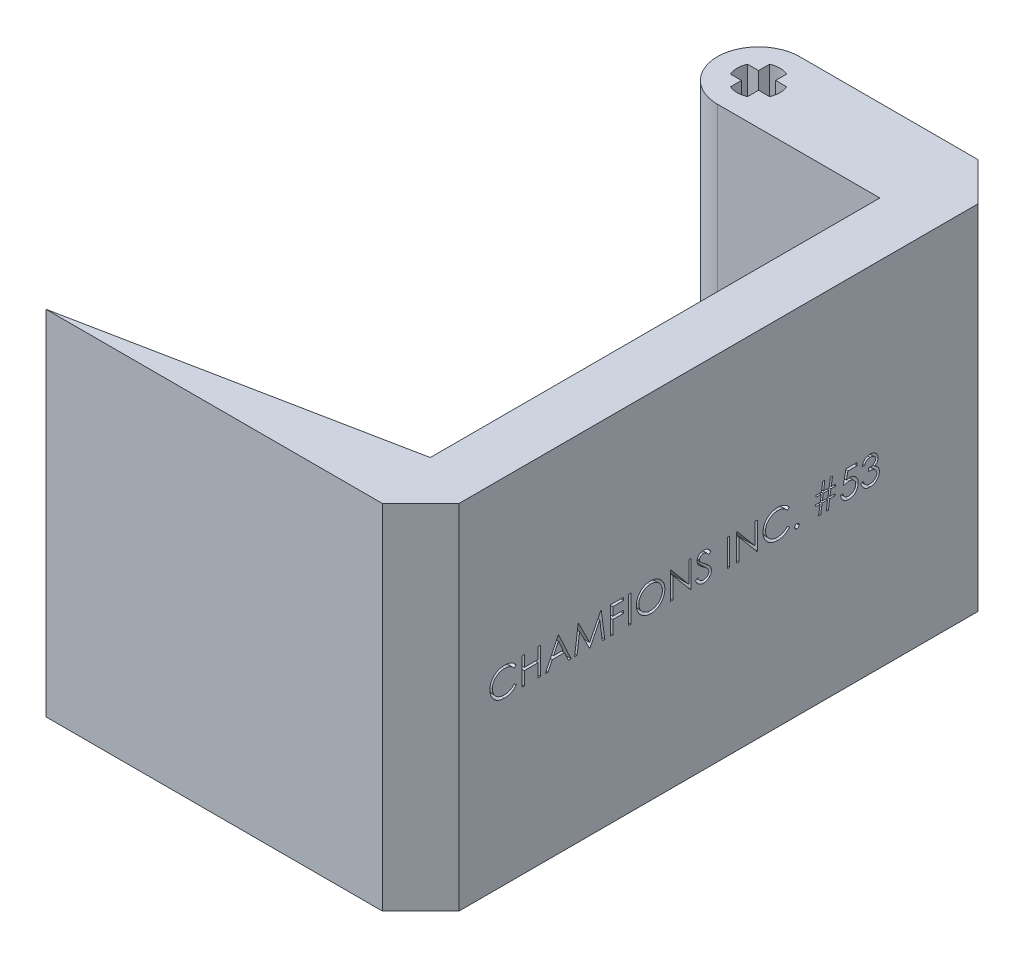
from build123d import *

# Parameters (mm, degrees)
BOSS_EXTRUDE6_DEPTH     = 41.402
CUT_EXTRUDE1_DEPTH      = 82.162837432
CUT_EXTRUDE2_DEPTH      = 82.162837432
CUT_EXTRUDE2_DEPTH_BACK = 82.162837432
SKETCH3_W               = 0.284935898
SKETCH3_H               = 3.175
SKETCH3_W_2             = 0.284935897


with BuildPart() as part:
    # Sketch1 → Boss-Extrude6 (new body)
    with BuildSketch(Plane(origin=(0, 0, 0), x_dir=(1, 0, 0), z_dir=(0, 1, 0))):
        with BuildLine():
            Line((25.4, 4.826), (0, 4.826))
            ThreePointArc((0, 4.826), (-4.826, 0), (0, -4.826))
            Line((0, -4.826), (19.05, -4.826))
            Line((19.05, -4.826), (19.05, -57.550565519))
            Line((19.05, -57.550565519), (-18.542, -65.024))
            Line((-18.542, -65.024), (25.4, -65.024))
            Line((25.4, -65.024), (25.4, 4.826))
        make_face()
        with BuildLine():
            Line((-1, 1), (-2.291287847, 1))
            ThreePointArc((-2.291287847, 1), (-2.5, 0), (-2.291287847, -1))
            Line((-2.291287847, -1), (-1, -1))
            Line((-1, -1), (-1, -2.291287847))
            ThreePointArc((-1, -2.291287847), (0, -2.5), (1, -2.291287847))
            Line((1, -2.291287847), (1, -1))
            Line((1, -1), (2.291287847, -1))
            ThreePointArc((2.291287847, -1), (2.5, 0), (2.291287847, 1))
            Line((2.291287847, 1), (1, 1))
            Line((1, 1), (1, 2.291287847))
            ThreePointArc((1, 2.291287847), (0, 2.5), (-1, 2.291287847))
            Line((-1, 2.291287847), (-1, 1))
        make_face(mode=Mode.SUBTRACT)
    extrude(amount=BOSS_EXTRUDE6_DEPTH)

    # Sketch2 → Cut-Extrude1 (cut, through all)
    with BuildSketch(Plane(origin=(0, 0, 0), x_dir=(1, 0, 0), z_dir=(0, 1, 0))):
        Polygon((25.4, -60.533871939), (20.909871939, -65.024), (25.4, -65.024), align=None)
        Polygon((25.4, 0.335871939), (20.909871939, 4.826), (25.4, 4.826), align=None)
    extrude(amount=CUT_EXTRUDE1_DEPTH, mode=Mode.SUBTRACT)

    # Sketch3 → Cut-Extrude2 (cut, two sides: drawn at the far end of the back side and taken through both)
    # profile 1 of 16: a face of its own
    with BuildSketch(Plane(origin=(0, 0, 0), x_dir=(0, 0, -1), z_dir=(1, 0, 0)).offset(-CUT_EXTRUDE2_DEPTH_BACK)):
        with BuildLine():
            Line((-53.812179487, 21.642407853), (-54.061498397, 21.451602564))
            add(Edge.make_bspline(
                [(-54.061498397, 21.451602564), (-54.079283739, 21.472798837), (-54.114614637, 21.51490561), (-54.171455485, 21.574032768), (-54.230693404, 21.629427684), (-54.29230575, 21.681354246), (-54.357401522, 21.727996598), (-54.424403818, 21.771785384), (-54.494433474, 21.811035404), (-54.591272547, 21.858626827), (-54.717953095, 21.90828941), (-54.877424128, 21.949930199), (-55.04389491, 21.97643798), (-55.157467018, 21.979308943), (-55.215234375, 21.980769231)],
                knots=[0, 0, 0, 0, 0.757959112, 1.505699292, 2.245454638, 2.979532153, 3.711538275, 4.438200793, 5.171680507, 5.909471876, 7.393775596, 8.890124382, 10.418191784, 12, 12, 12, 12], degree=3))
            add(Edge.make_bspline(
                [(-55.215234375, 21.980769231), (-55.247059939, 21.980402779), (-55.310415697, 21.979673277), (-55.404439669, 21.970049285), (-55.496707937, 21.956522687), (-55.587160482, 21.936451858), (-55.675682165, 21.911076696), (-55.762851701, 21.880755071), (-55.847407031, 21.843240323), (-55.930517862, 21.801776402), (-56.010146146, 21.754942934), (-56.085488939, 21.703858679), (-56.156271453, 21.649095284), (-56.22254968, 21.590447495), (-56.284391376, 21.528179431), (-56.341348436, 21.461627492), (-56.393223773, 21.391004449), (-56.441045645, 21.317241573), (-56.483874339, 21.240553719), (-56.519733587, 21.160657048), (-56.551488234, 21.078919754), (-56.576615404, 20.994418344), (-56.596504073, 20.907747406), (-56.610227024, 20.818674334), (-56.619741566, 20.727385211), (-56.620467441, 20.66550962), (-56.620833333, 20.634319912)],
                knots=[0, 0, 0, 0, 1.054917814, 2.100044995, 3.131103042, 4.146048494, 5.169673617, 6.183595914, 7.203665975, 8.234915748, 9.262203917, 10.264457458, 11.251630812, 12.227803204, 13.197192746, 14.159520551, 15.12972552, 16.100847026, 17.073214652, 18.039054194, 19.002613845, 19.979014051, 20.95965708, 21.949030935, 22.966165397, 24, 24, 24, 24], degree=3))
            add(Edge.make_bspline(
                [(-56.620833333, 20.634319912), (-56.619688683, 20.587392215), (-56.617441315, 20.495255905), (-56.597440326, 20.360299709), (-56.567046422, 20.231013097), (-56.52149372, 20.108204241), (-56.465324295, 19.990358801), (-56.394348883, 19.879470699), (-56.312146739, 19.773864244), (-56.217554944, 19.676035284), (-56.113772525, 19.586669262), (-56.002422634, 19.507974091), (-55.883782601, 19.442374162), (-55.759162373, 19.387785982), (-55.627602969, 19.345824522), (-55.48934097, 19.31628421), (-55.344677088, 19.297014518), (-55.245826276, 19.295169672), (-55.195517829, 19.294230769)],
                knots=[0, 0, 0, 0, 1.029171465, 2.020641659, 2.987623507, 3.938342917, 4.889210282, 5.84687017, 6.821220943, 7.821438502, 8.827599549, 9.822697543, 10.807740252, 11.797342354, 12.80366471, 13.83203677, 14.896651826, 16, 16, 16, 16], degree=3))
            add(Edge.make_bspline(
                [(-55.195517829, 19.294230769), (-55.140088961, 19.295762734), (-55.030991689, 19.298778006), (-54.871000694, 19.324322468), (-54.717842535, 19.365740722), (-54.571508974, 19.423705266), (-54.432412545, 19.499057348), (-54.300335575, 19.590404709), (-54.175166579, 19.698616268), (-54.099899773, 19.781241677), (-54.061498397, 19.823397436)],
                knots=[0, 0, 0, 0, 1.028121516, 2.023589091, 2.998037872, 3.967518031, 4.937445131, 5.927275754, 6.942489185, 8, 8, 8, 8], degree=3))
            Line((-54.061498397, 19.823397436), (-53.812179487, 19.6345002))
            add(Edge.make_bspline(
                [(-53.812179487, 19.6345002), (-53.832243773, 19.608611748), (-53.872276237, 19.556958846), (-53.937098866, 19.484140938), (-54.005386129, 19.415647992), (-54.077645237, 19.352032221), (-54.153044948, 19.29202067), (-54.232939117, 19.237318294), (-54.316277454, 19.187161564), (-54.402777588, 19.141235711), (-54.492347616, 19.100489351), (-54.58488021, 19.06560629), (-54.679976518, 19.035557283), (-54.777640886, 19.010835883), (-54.878075894, 18.991539972), (-54.98091911, 18.978640695), (-55.086392497, 18.969803387), (-55.157550072, 18.968997921), (-55.193609776, 18.968589744)],
                knots=[0, 0, 0, 0, 0.986787822, 1.968848986, 2.935600012, 3.899624008, 4.868462664, 5.837806735, 6.815139263, 7.798259679, 8.787526145, 9.778297419, 10.776456485, 11.791383307, 12.812564526, 13.85620153, 14.913611965, 16, 16, 16, 16], degree=3))
            add(Edge.make_bspline(
                [(-55.193609776, 18.968589744), (-55.227757959, 18.968827408), (-55.295281764, 18.969297361), (-55.394975631, 18.976910255), (-55.492030465, 18.987296803), (-55.586168876, 19.002936064), (-55.677904582, 19.021391287), (-55.766405969, 19.046130213), (-55.85254391, 19.073842671), (-55.935972334, 19.106413623), (-56.016762204, 19.143167589), (-56.094652947, 19.184707074), (-56.169608739, 19.230682766), (-56.242366514, 19.28008124), (-56.311851465, 19.334489221), (-56.378665734, 19.393151096), (-56.443183981, 19.455869149), (-56.483100702, 19.501094623), (-56.503170072, 19.523833133)],
                knots=[0, 0, 0, 0, 1.114604814, 2.203992996, 3.262667896, 4.300477797, 5.318619304, 6.316056647, 7.298880507, 8.271930387, 9.238335007, 10.195173496, 11.151986948, 12.108099108, 13.064862484, 14.031167946, 15.010108607, 16, 16, 16, 16], degree=3))
            add(Edge.make_bspline(
                [(-56.503170072, 19.523833133), (-56.535315263, 19.563331212), (-56.59921756, 19.641850513), (-56.68097443, 19.769109939), (-56.750958284, 19.901977528), (-56.807542155, 20.041151321), (-56.85177692, 20.186319022), (-56.882421289, 20.33755381), (-56.902334531, 20.494714444), (-56.904611721, 20.601609245), (-56.905769231, 20.655944511)],
                knots=[0, 0, 0, 0, 0.994628077, 1.977248131, 2.950237994, 3.925870899, 4.908910175, 5.911660606, 6.938484602, 8, 8, 8, 8], degree=3))
            add(Edge.make_bspline(
                [(-56.905769231, 20.655944511), (-56.904358448, 20.713054101), (-56.901582821, 20.825413654), (-56.878000921, 20.990308598), (-56.840065299, 21.148288795), (-56.786183835, 21.299059335), (-56.717871124, 21.443413232), (-56.633482696, 21.580247753), (-56.533998931, 21.710437993), (-56.420200066, 21.832008518), (-56.29540684, 21.943169216), (-56.161767631, 22.040964844), (-56.019544007, 22.122351447), (-55.870302813, 22.19038368), (-55.712926516, 22.242675443), (-55.547750889, 22.279281549), (-55.375086302, 22.302066361), (-55.25728253, 22.304946728), (-55.197425881, 22.306410256)],
                knots=[0, 0, 0, 0, 1.032925535, 2.032216505, 3.007276963, 3.968222605, 4.92396291, 5.891752235, 6.871517503, 7.883894988, 8.900124299, 9.891468569, 10.874487609, 11.85992873, 12.854644235, 13.869047385, 14.917252991, 16, 16, 16, 16], degree=3))
            add(Edge.make_bspline(
                [(-55.197425881, 22.306410256), (-55.16094561, 22.305972888), (-55.088736588, 22.305107162), (-54.98191811, 22.296665162), (-54.877921142, 22.282592104), (-54.776674037, 22.263436813), (-54.677684235, 22.239663028), (-54.581708303, 22.2086929), (-54.488183065, 22.17328119), (-54.39769837, 22.132497439), (-54.310688357, 22.086716895), (-54.227180125, 22.036447007), (-54.147837003, 21.981750098), (-54.07210069, 21.92309136), (-54.001238128, 21.85922981), (-53.933237358, 21.791921991), (-53.870407665, 21.719229165), (-53.83162441, 21.668061832), (-53.812179487, 21.642407853)],
                knots=[0, 0, 0, 0, 1.096760587, 2.17092713, 3.219439832, 4.250915756, 5.268269357, 6.278326846, 7.281116186, 8.274029601, 9.260640565, 10.235837813, 11.203064059, 12.156899882, 13.114053108, 14.069676657, 15.032185724, 16, 16, 16, 16], degree=3))
        make_face()
    # profile 2 of 16: a face of its own
    with BuildSketch(Plane(origin=(0, 0, 0), x_dir=(0, 0, -1), z_dir=(1, 0, 0)).offset(-CUT_EXTRUDE2_DEPTH_BACK)):
        Polygon((-53.160897436, 22.225), (-52.875961538, 22.225), (-52.875961538, 20.922435897), (-51.24775641, 20.922435897), (-51.24775641, 22.225), (-50.962820513, 22.225), (-50.962820513, 19.05), (-51.24775641, 19.05), (-51.24775641, 20.596794872), (-52.875961538, 20.596794872), (-52.875961538, 19.05), (-53.160897436, 19.05), align=None)
    # profile 3 of 16: a face of its own
    with BuildSketch(Plane(origin=(0, 0, 0), x_dir=(0, 0, -1), z_dir=(1, 0, 0)).offset(-CUT_EXTRUDE2_DEPTH_BACK)):
        Polygon((-48.846153846, 22.225), (-47.380769231, 19.05), (-47.690509816, 19.05), (-48.159890825, 20.067628205), (-49.599198718, 20.067628205), (-50.081936098, 19.05), (-50.392948718, 19.05), (-48.886858974, 22.225), align=None)
        Polygon((-48.869686498, 21.606154848), (-49.444646434, 20.393269231), (-48.309990986, 20.393269231), align=None, mode=Mode.SUBTRACT)
    # profile 4 of 16: a face of its own
    with BuildSketch(Plane(origin=(0, 0, 0), x_dir=(0, 0, -1), z_dir=(1, 0, 0)).offset(-CUT_EXTRUDE2_DEPTH_BACK)):
        Polygon((-46.973717949, 19.05), (-46.554582332, 22.225), (-46.513877204, 22.225), (-45.203044872, 19.619871795), (-43.895392628, 22.225), (-43.854051482, 22.225), (-43.432371795, 19.05), (-43.718579728, 19.05), (-44.022596154, 21.334575321), (-45.16869992, 19.05), (-45.2329377, 19.05), (-46.38349359, 21.339663462), (-46.686873998, 19.05), align=None)
    # profile 5 of 16: a face of its own
    with BuildSketch(Plane(origin=(0, 0, 0), x_dir=(0, 0, -1), z_dir=(1, 0, 0)).offset(-CUT_EXTRUDE2_DEPTH_BACK)):
        Polygon((-42.781089744, 22.225), (-41.234294872, 22.225), (-41.234294872, 21.899358974), (-42.496153846, 21.899358974), (-42.496153846, 20.922435897), (-41.234294872, 20.922435897), (-41.234294872, 20.596794872), (-42.496153846, 20.596794872), (-42.496153846, 19.05), (-42.781089744, 19.05), align=None)
    # profile 6 of 16: a face of its own
    with BuildSketch(Plane(origin=(0, 0, 0), x_dir=(0, 0, -1), z_dir=(1, 0, 0)).offset(-CUT_EXTRUDE2_DEPTH_BACK)):
        with Locations((-40.521955128, 20.6375)):
            Rectangle(SKETCH3_W, SKETCH3_H)
    # profile 7 of 16: a face of its own
    with BuildSketch(Plane(origin=(0, 0, 0), x_dir=(0, 0, -1), z_dir=(1, 0, 0)).offset(-CUT_EXTRUDE2_DEPTH_BACK)):
        with BuildLine():
            add(Edge.make_bspline(
                [(-38.079647436, 22.306410256), (-38.020857226, 22.3049212), (-37.905388402, 22.301996571), (-37.735684745, 22.279609098), (-37.57367348, 22.24087828), (-37.418034854, 22.189295432), (-37.270630511, 22.120484668), (-37.130350944, 22.03731314), (-36.997529923, 21.938909496), (-36.87395767, 21.826034411), (-36.760876007, 21.703222278), (-36.661248239, 21.572160174), (-36.57775273, 21.433640546), (-36.509185623, 21.28807965), (-36.455393313, 21.135806679), (-36.418273895, 20.976009834), (-36.394562858, 20.809724479), (-36.391790832, 20.696307252), (-36.390384615, 20.638772035)],
                knots=[0, 0, 0, 0, 1.065120563, 2.091984664, 3.0946048, 4.079830382, 5.057816894, 6.036188127, 7.030412546, 8.04752943, 9.064399622, 10.05169764, 11.02544977, 11.989514704, 12.962713494, 13.945757189, 14.957906945, 16, 16, 16, 16], degree=3))
            add(Edge.make_bspline(
                [(-36.390384615, 20.638772035), (-36.391790626, 20.581660637), (-36.394562035, 20.469087456), (-36.418300854, 20.303857332), (-36.455530904, 20.145025057), (-36.508686089, 19.992855786), (-36.576926344, 19.847188996), (-36.660977821, 19.708407974), (-36.75998449, 19.576467222), (-36.872657848, 19.452812161), (-36.995485936, 19.339421599), (-37.127230535, 19.240616618), (-37.264928761, 19.155595448), (-37.410352568, 19.087755973), (-37.561573316, 19.033534302), (-37.719944423, 18.996565845), (-37.884723797, 18.972719741), (-37.997092493, 18.969981516), (-38.054206731, 18.968589744)],
                knots=[0, 0, 0, 0, 1.043624062, 2.057103931, 3.04512605, 4.022047818, 4.998200453, 5.980619268, 6.982898556, 8.009068085, 9.034988726, 10.034168286, 11.015286542, 11.987931943, 12.962482838, 13.94673481, 14.956375938, 16, 16, 16, 16], degree=3))
            add(Edge.make_bspline(
                [(-38.054206731, 18.968589744), (-38.111741649, 18.969995259), (-38.225158287, 18.972765903), (-38.391652598, 18.996516178), (-38.551561694, 19.033655789), (-38.704428284, 19.086732206), (-38.850337613, 19.155327837), (-38.989575045, 19.238970381), (-39.1215817, 19.338218287), (-39.245263142, 19.450855109), (-39.358428486, 19.573475017), (-39.457088777, 19.704860377), (-39.54075013, 19.842433541), (-39.609115438, 19.986576295), (-39.663239626, 20.136591818), (-39.700164712, 20.293480794), (-39.724055182, 20.456348774), (-39.726808222, 20.567240546), (-39.728205128, 20.623507612)],
                knots=[0, 0, 0, 0, 1.053102029, 2.075944431, 3.073151272, 4.055350789, 5.033113405, 6.020478099, 7.024410459, 8.052272461, 9.079885166, 10.07527673, 11.055994387, 12.023226415, 12.992069828, 13.970394897, 14.97016774, 16, 16, 16, 16], degree=3))
            add(Edge.make_bspline(
                [(-39.728205128, 20.623507612), (-39.727720137, 20.661274391), (-39.726756274, 20.736331503), (-39.715152382, 20.847789061), (-39.698314267, 20.957454158), (-39.674182532, 21.065014947), (-39.64262152, 21.170208126), (-39.605381467, 21.273759175), (-39.559897464, 21.374618696), (-39.508480019, 21.473264487), (-39.451092522, 21.568158801), (-39.387705235, 21.657856709), (-39.320544579, 21.743110899), (-39.246917786, 21.821712109), (-39.16925144, 21.895946926), (-39.086285625, 21.964674534), (-38.998526589, 22.028514668), (-38.905596716, 22.086045977), (-38.809785852, 22.138078906), (-38.711019061, 22.182730157), (-38.610637743, 22.22105337), (-38.508171741, 22.25211469), (-38.403893155, 22.276636608), (-38.297574393, 22.293334708), (-38.189300156, 22.304968196), (-38.116355602, 22.305927501), (-38.079647436, 22.306410256)],
                knots=[0, 0, 0, 0, 1.037015668, 2.060948919, 3.074880161, 4.083647147, 5.086022904, 6.090072063, 7.104153813, 8.122640571, 9.144368836, 10.147691507, 11.138137339, 12.123020368, 13.103399296, 14.087645067, 15.080126199, 16.082011238, 17.087798457, 18.072939717, 19.057185487, 20.037253025, 21.01195951, 21.997135196, 22.992090687, 24, 24, 24, 24], degree=3))
        make_face()
        with BuildLine():
            add(Edge.make_bspline(
                [(-38.065655048, 21.980769231), (-38.095785466, 21.980401937), (-38.155758252, 21.979670862), (-38.244916367, 21.970040892), (-38.332901907, 21.956315921), (-38.419733043, 21.936738399), (-38.505046462, 21.910064722), (-38.58963739, 21.879366184), (-38.672734446, 21.841972766), (-38.754063302, 21.79972467), (-38.832907692, 21.752962435), (-38.907304928, 21.701280903), (-38.977447613, 21.645892072), (-39.043164004, 21.586666676), (-39.104261139, 21.523303109), (-39.161941547, 21.456761971), (-39.213893239, 21.385141327), (-39.261505155, 21.310383315), (-39.304111696, 21.232585309), (-39.341998839, 21.152566362), (-39.372990476, 21.069673747), (-39.398265631, 20.984806761), (-39.41922046, 20.898099815), (-39.432495519, 20.808895152), (-39.442231303, 20.717641015), (-39.442920591, 20.655971762), (-39.443269231, 20.624779647)],
                knots=[0, 0, 0, 0, 1.008559885, 2.007477868, 2.99961109, 3.989939068, 4.984837346, 5.991145699, 7.001802488, 8.033829008, 9.059044045, 10.069351652, 11.065060232, 12.050310815, 13.029377138, 14.011219647, 14.996725999, 15.989392538, 16.977580475, 17.965360261, 18.951710183, 19.937753436, 20.929683414, 21.935841486, 22.955955122, 24, 24, 24, 24], degree=3))
            add(Edge.make_bspline(
                [(-39.443269231, 20.624779647), (-39.442112749, 20.57891249), (-39.439837591, 20.488677602), (-39.419918938, 20.356445071), (-39.389237576, 20.229364983), (-39.344009822, 20.10813268), (-39.287448907, 19.99170608), (-39.217574514, 19.881118014), (-39.134789486, 19.776338592), (-39.040751859, 19.678099312), (-38.937951975, 19.588432047), (-38.828792998, 19.509725241), (-38.714444369, 19.443131657), (-38.594607892, 19.388879913), (-38.469923339, 19.34589065), (-38.339587274, 19.316427892), (-38.204467929, 19.297037301), (-38.11236512, 19.295175158), (-38.065655048, 19.294230769)],
                knots=[0, 0, 0, 0, 1.032063989, 2.030389145, 3.003944642, 3.970395727, 4.937377036, 5.913328081, 6.909231446, 7.93887556, 8.970685674, 9.976071282, 10.964166581, 11.944589148, 12.933237628, 13.927779006, 14.949070134, 16, 16, 16, 16], degree=3))
            add(Edge.make_bspline(
                [(-38.065655048, 19.294230769), (-38.034259286, 19.29466212), (-37.97199206, 19.295517617), (-37.879376836, 19.304134274), (-37.78843013, 19.317951755), (-37.699279505, 19.337845993), (-37.61202614, 19.36274453), (-37.526305854, 19.392324398), (-37.443031691, 19.429228061), (-37.361153124, 19.470002274), (-37.28277939, 19.516484417), (-37.2079623, 19.566411882), (-37.138587661, 19.62171913), (-37.072920432, 19.680064575), (-37.011572457, 19.742624637), (-36.954958593, 19.809317981), (-36.903269473, 19.880565577), (-36.855675637, 19.955210195), (-36.813218391, 20.033221081), (-36.776225923, 20.113530146), (-36.744842303, 20.195939638), (-36.71950716, 20.280568421), (-36.699653919, 20.367255762), (-36.685974278, 20.456117733), (-36.676405337, 20.546976565), (-36.675684088, 20.608429921), (-36.675320513, 20.639408053)],
                knots=[0, 0, 0, 0, 1.047197238, 2.076906641, 3.100256066, 4.114471768, 5.12198147, 6.126382909, 7.136867548, 8.15857795, 9.17633901, 10.174870724, 11.156907918, 12.133735059, 13.104061851, 14.077631395, 15.04955518, 16.038496417, 17.029181396, 18.010275684, 18.986308667, 19.968651475, 20.955262928, 21.950658345, 22.966943676, 24, 24, 24, 24], degree=3))
            add(Edge.make_bspline(
                [(-36.675320513, 20.639408053), (-36.67568438, 20.67017426), (-36.676406176, 20.7312047), (-36.685969707, 20.821429871), (-36.699668372, 20.909652427), (-36.719410257, 20.99552602), (-36.744855754, 21.079072539), (-36.776231403, 21.160213517), (-36.813229496, 21.239251237), (-36.855691243, 21.315990349), (-36.903421311, 21.389627433), (-36.955576803, 21.460023907), (-37.013058226, 21.525857751), (-37.074223263, 21.588754224), (-37.140599709, 21.647371881), (-37.21188689, 21.701730167), (-37.287219369, 21.753140923), (-37.366981933, 21.799519112), (-37.449299662, 21.842349166), (-37.533767324, 21.879044004), (-37.619428007, 21.910224427), (-37.706063881, 21.936819102), (-37.794404154, 21.956239244), (-37.883851913, 21.97005326), (-37.974283405, 21.97966751), (-38.035101183, 21.980400825), (-38.065655048, 21.980769231)],
                knots=[0, 0, 0, 0, 1.02996197, 2.043119294, 3.035359645, 4.018872909, 4.991431989, 5.957985074, 6.929999688, 7.912076566, 8.892894881, 9.867085534, 10.843653904, 11.817741046, 12.803660682, 13.806313499, 14.818574707, 15.856120519, 16.894564902, 17.924820532, 18.937903209, 19.946497019, 20.957711757, 21.963978472, 22.977135795, 24, 24, 24, 24], degree=3))
        make_face(mode=Mode.SUBTRACT)
    # profile 8 of 16: a face of its own
    with BuildSketch(Plane(origin=(0, 0, 0), x_dir=(0, 0, -1), z_dir=(1, 0, 0)).offset(-CUT_EXTRUDE2_DEPTH_BACK)):
        Polygon((-35.739102564, 19.05), (-35.739102564, 22.225), (-35.679316907, 22.225), (-33.581730769, 19.726086739), (-33.581730769, 22.225), (-33.296794872, 22.225), (-33.296794872, 19.05), (-33.36166867, 19.05), (-35.454166667, 21.543189103), (-35.454166667, 19.05), align=None)
    # profile 9 of 16: a face of its own
    with BuildSketch(Plane(origin=(0, 0, 0), x_dir=(0, 0, -1), z_dir=(1, 0, 0)).offset(-CUT_EXTRUDE2_DEPTH_BACK)):
        with BuildLine():
            Line((-32.808333333, 19.662484976), (-32.539933894, 19.823397436))
            add(Edge.make_bspline(
                [(-32.539933894, 19.823397436), (-32.514970922, 19.781610458), (-32.46714283, 19.701548221), (-32.387358383, 19.593364142), (-32.304687814, 19.501414185), (-32.218518918, 19.426233263), (-32.129377665, 19.367043201), (-32.036682131, 19.325131177), (-31.940744688, 19.29899097), (-31.87545415, 19.295815892), (-31.842858574, 19.294230769)],
                knots=[0, 0, 0, 0, 1.272034388, 2.437168799, 3.508375237, 4.49857839, 5.41946034, 6.295179144, 7.148887113, 8, 8, 8, 8], degree=3))
            add(Edge.make_bspline(
                [(-31.842858574, 19.294230769), (-31.815021207, 19.295006079), (-31.759833563, 19.296543133), (-31.678587814, 19.311312147), (-31.599682894, 19.334001721), (-31.524745058, 19.366496423), (-31.454808322, 19.405810621), (-31.393479391, 19.453296082), (-31.340460417, 19.506460283), (-31.29709072, 19.565771691), (-31.263816688, 19.62955939), (-31.238242455, 19.695033288), (-31.224050138, 19.763221918), (-31.221912226, 19.809132838), (-31.220833333, 19.832301683)],
                knots=[0, 0, 0, 0, 1.095163259, 2.171163733, 3.241058638, 4.321873601, 5.38011039, 6.391990106, 7.366004449, 8.327778327, 9.272591725, 10.192022065, 11.087607919, 12, 12, 12, 12], degree=3))
            add(Edge.make_bspline(
                [(-31.220833333, 19.832301683), (-31.222170744, 19.858736596), (-31.224889504, 19.912474913), (-31.247868775, 19.991758884), (-31.284017735, 20.070220001), (-31.317366704, 20.118753292), (-31.334680489, 20.143950321)],
                knots=[0, 0, 0, 0, 0.938893495, 1.908633276, 2.914225137, 4, 4, 4, 4], degree=3))
            add(Edge.make_bspline(
                [(-31.334680489, 20.143950321), (-31.348895975, 20.162135653), (-31.378739609, 20.200313485), (-31.430045352, 20.257141663), (-31.490248899, 20.3157598), (-31.557289981, 20.37840623), (-31.633610711, 20.442167303), (-31.716820671, 20.510083527), (-31.809044314, 20.5795721), (-31.873723143, 20.626174356), (-31.907096354, 20.650220353)],
                knots=[0, 0, 0, 0, 0.722233717, 1.516239348, 2.393582979, 3.351407094, 4.387010283, 5.505090956, 6.712668013, 8, 8, 8, 8], degree=3))
            add(Edge.make_bspline(
                [(-31.907096354, 20.650220353), (-31.940500979, 20.674013428), (-32.004368079, 20.719503978), (-32.093684078, 20.787017435), (-32.173552984, 20.848742946), (-32.243619806, 20.905261585), (-32.303853726, 20.95658102), (-32.354729392, 21.002208436), (-32.394950797, 21.043377809), (-32.417316931, 21.070085312), (-32.427358774, 21.082076322)],
                knots=[0, 0, 0, 0, 1.452282411, 2.77665338, 3.964542531, 5.026858415, 5.96415736, 6.766646006, 7.446254459, 8, 8, 8, 8], degree=3))
            add(Edge.make_bspline(
                [(-32.427358774, 21.082076322), (-32.441394583, 21.100764406), (-32.468997885, 21.13751703), (-32.50543419, 21.194961722), (-32.536403287, 21.253765684), (-32.560680546, 21.314086933), (-32.581124116, 21.375078618), (-32.594874524, 21.437536534), (-32.603484577, 21.501180424), (-32.604366308, 21.544009814), (-32.604807692, 21.56544972)],
                knots=[0, 0, 0, 0, 1.068054152, 2.10047183, 3.106115577, 4.101338837, 5.06977816, 6.043150881, 7.020423561, 8, 8, 8, 8], degree=3))
            add(Edge.make_bspline(
                [(-32.604807692, 21.56544972), (-32.603623681, 21.599041015), (-32.601280967, 21.665505616), (-32.581468497, 21.762597869), (-32.550196658, 21.855295548), (-32.506386296, 21.942680922), (-32.449909983, 22.022478633), (-32.384553992, 22.095606582), (-32.306710715, 22.157082367), (-32.221300835, 22.210796163), (-32.127813983, 22.252838538), (-32.029850807, 22.284553141), (-31.927255606, 22.302522968), (-31.857765619, 22.305101762), (-31.82250601, 22.306410256)],
                knots=[0, 0, 0, 0, 1.005424448, 1.989358655, 2.955360095, 3.929531133, 4.905563448, 5.876582895, 6.856512386, 7.866279853, 8.892233794, 9.918561126, 10.94386622, 12, 12, 12, 12], degree=3))
            add(Edge.make_bspline(
                [(-31.82250601, 22.306410256), (-31.785091719, 22.305119799), (-31.710686635, 22.302553491), (-31.601240561, 22.280240016), (-31.495866197, 22.243318692), (-31.411099807, 22.201418981), (-31.344757945, 22.159571197), (-31.294164108, 22.121453213), (-31.242894707, 22.077570079), (-31.190536186, 22.027804906), (-31.13797573, 21.971701067), (-31.084433027, 21.9096428), (-31.029782869, 21.842009352), (-30.994625767, 21.793727127), (-30.976602564, 21.768975361)],
                knots=[0, 0, 0, 0, 1.286793592, 2.559021753, 3.825965368, 5.121522368, 5.803751409, 6.523245864, 7.299691795, 8.125521123, 9.008227632, 9.944561021, 10.946284179, 12, 12, 12, 12], degree=3))
            Line((-30.976602564, 21.768975361), (-31.234189704, 21.573717949))
            add(Edge.make_bspline(
                [(-31.234189704, 21.573717949), (-31.249743514, 21.593755546), (-31.279696515, 21.632343275), (-31.325171121, 21.686382968), (-31.368032395, 21.735746489), (-31.410260258, 21.778622712), (-31.44962448, 21.817359647), (-31.487830654, 21.85052457), (-31.524328959, 21.878442431), (-31.570336442, 21.908236232), (-31.628137515, 21.937769632), (-31.700694916, 21.962760581), (-31.776519608, 21.977778387), (-31.828162917, 21.979764021), (-31.854306891, 21.980769231)],
                knots=[0, 0, 0, 0, 1.181633172, 2.275549214, 3.290209073, 4.226197932, 5.078386478, 5.862611352, 6.581680152, 7.217281963, 8.414376989, 9.595101626, 10.782541182, 12, 12, 12, 12], degree=3))
            add(Edge.make_bspline(
                [(-31.854306891, 21.980769231), (-31.887106022, 21.979670046), (-31.950356057, 21.977550371), (-32.040154342, 21.954400099), (-32.12097526, 21.917949411), (-32.190419372, 21.866863681), (-32.248237916, 21.806338209), (-32.290062153, 21.736688819), (-32.315235517, 21.659779068), (-32.318307356, 21.606129137), (-32.319871795, 21.57880609)],
                knots=[0, 0, 0, 0, 1.14458467, 2.207223713, 3.21896685, 4.227309161, 5.202851033, 6.127160689, 7.046193047, 8, 8, 8, 8], degree=3))
            add(Edge.make_bspline(
                [(-32.319871795, 21.57880609), (-32.319515173, 21.56179582), (-32.318801346, 21.527747465), (-32.308845636, 21.477445104), (-32.296055531, 21.427269817), (-32.275787572, 21.377447189), (-32.247806475, 21.327105877), (-32.211062494, 21.275379015), (-32.164786132, 21.22181068), (-32.1293377, 21.186969705), (-32.110621995, 21.16857472)],
                knots=[0, 0, 0, 0, 0.858281714, 1.717966888, 2.583508476, 3.4729293, 4.427298488, 5.488583878, 6.674047936, 8, 8, 8, 8], degree=3))
            add(Edge.make_bspline(
                [(-32.110621995, 21.16857472), (-32.103672036, 21.16237256), (-32.087160524, 21.14763765), (-32.056974505, 21.123514653), (-32.01711211, 21.093757852), (-31.968614256, 21.056939358), (-31.910586721, 21.014229746), (-31.843023123, 20.966175112), (-31.76667659, 20.911215445), (-31.71250028, 20.872791105), (-31.683854167, 20.852473958)],
                knots=[0, 0, 0, 0, 0.420754252, 0.999615792, 1.744751191, 2.668019286, 3.750313428, 4.999500688, 6.413464383, 8, 8, 8, 8], degree=3))
            add(Edge.make_bspline(
                [(-31.683854167, 20.852473958), (-31.649395517, 20.827399296), (-31.582671117, 20.778845689), (-31.487731741, 20.705897179), (-31.401649501, 20.634552418), (-31.324122166, 20.565267017), (-31.254383828, 20.498566533), (-31.193208181, 20.433648505), (-31.139971885, 20.370978021), (-31.082659309, 20.290630042), (-31.024096144, 20.191950058), (-30.973802776, 20.071047656), (-30.942090561, 19.949675279), (-30.937943544, 19.868098792), (-30.935897436, 19.827849559)],
                knots=[0, 0, 0, 0, 1.163667725, 2.253281268, 3.268753668, 4.215851969, 5.092017293, 5.902905408, 6.650798638, 7.335211899, 8.59617414, 9.77448103, 10.901945474, 12, 12, 12, 12], degree=3))
            add(Edge.make_bspline(
                [(-30.935897436, 19.827849559), (-30.936493554, 19.7993849), (-30.937674214, 19.743008344), (-30.9512459, 19.660226953), (-30.971130168, 19.579826093), (-31.001099659, 19.502799584), (-31.037678524, 19.427738263), (-31.08409362, 19.356611097), (-31.137894163, 19.287843864), (-31.199610506, 19.223270268), (-31.267143575, 19.163991933), (-31.338520927, 19.11126057), (-31.413859388, 19.067292877), (-31.492750261, 19.031414613), (-31.575211667, 19.003353493), (-31.661215871, 18.983021819), (-31.750904642, 18.970543424), (-31.811865079, 18.969248241), (-31.842858574, 18.968589744)],
                knots=[0, 0, 0, 0, 0.983748083, 1.948392443, 2.894712957, 3.844097841, 4.80183111, 5.778335162, 6.776009319, 7.81870978, 8.863265674, 9.881300176, 10.883814829, 11.87499822, 12.874611388, 13.892143829, 14.928324115, 16, 16, 16, 16], degree=3))
            add(Edge.make_bspline(
                [(-31.842858574, 18.968589744), (-31.866839206, 18.969053458), (-31.91449846, 18.969975048), (-31.984992061, 18.978122352), (-32.054061546, 18.98964951), (-32.120840216, 19.007950274), (-32.186188439, 19.030154389), (-32.249822002, 19.057494162), (-32.311771744, 19.090257623), (-32.372384837, 19.12771811), (-32.431507124, 19.17131335), (-32.48858407, 19.222089307), (-32.545488402, 19.278645587), (-32.600540541, 19.342518026), (-32.654854036, 19.412674716), (-32.707358021, 19.489772046), (-32.759139294, 19.573390074), (-32.79162904, 19.632231974), (-32.808333333, 19.662484976)],
                knots=[0, 0, 0, 0, 0.915332311, 1.819136955, 2.706846663, 3.586547465, 4.459518054, 5.340707479, 6.227863349, 7.133153174, 8.059268498, 9.028702269, 10.047606654, 11.120612155, 12.245963614, 13.433783089, 14.680604001, 16, 16, 16, 16], degree=3))
        make_face()
    # profile 10 of 16: a face of its own
    with BuildSketch(Plane(origin=(0, 0, 0), x_dir=(0, 0, -1), z_dir=(1, 0, 0)).offset(-CUT_EXTRUDE2_DEPTH_BACK)):
        with Locations((-28.92099359, 20.6375)):
            Rectangle(SKETCH3_W_2, SKETCH3_H)
    # profile 11 of 16: a face of its own
    with BuildSketch(Plane(origin=(0, 0, 0), x_dir=(0, 0, -1), z_dir=(1, 0, 0)).offset(-CUT_EXTRUDE2_DEPTH_BACK)):
        Polygon((-27.964423077, 19.05), (-27.964423077, 22.225), (-27.90463742, 22.225), (-25.807051282, 19.726086739), (-25.807051282, 22.225), (-25.522115385, 22.225), (-25.522115385, 19.05), (-25.586989183, 19.05), (-27.679487179, 21.543189103), (-27.679487179, 19.05), align=None)
    # profile 12 of 16: a face of its own
    with BuildSketch(Plane(origin=(0, 0, 0), x_dir=(0, 0, -1), z_dir=(1, 0, 0)).offset(-CUT_EXTRUDE2_DEPTH_BACK)):
        with BuildLine():
            Line((-21.77724359, 21.642407853), (-22.0265625, 21.451602564))
            add(Edge.make_bspline(
                [(-22.0265625, 21.451602564), (-22.044347842, 21.472798837), (-22.07967874, 21.51490561), (-22.136519588, 21.574032768), (-22.195757507, 21.629427684), (-22.257369852, 21.681354246), (-22.322465625, 21.727996598), (-22.389467921, 21.771785384), (-22.459497576, 21.811035404), (-22.55633665, 21.858626827), (-22.683017198, 21.90828941), (-22.842488231, 21.949930199), (-23.008959013, 21.97643798), (-23.122531121, 21.979308943), (-23.180298478, 21.980769231)],
                knots=[0, 0, 0, 0, 0.757959112, 1.505699292, 2.245454638, 2.979532153, 3.711538275, 4.438200793, 5.171680507, 5.909471876, 7.393775596, 8.890124382, 10.418191784, 12, 12, 12, 12], degree=3))
            add(Edge.make_bspline(
                [(-23.180298478, 21.980769231), (-23.212124042, 21.980402779), (-23.2754798, 21.979673277), (-23.369503772, 21.970049285), (-23.46177204, 21.956522687), (-23.552224584, 21.936451858), (-23.640746268, 21.911076696), (-23.727915804, 21.880755071), (-23.812471134, 21.843240323), (-23.895581964, 21.801776402), (-23.975210249, 21.754942934), (-24.050553042, 21.703858679), (-24.121335556, 21.649095284), (-24.187613782, 21.590447495), (-24.249455478, 21.528179431), (-24.306412539, 21.461627492), (-24.358287875, 21.391004449), (-24.406109748, 21.317241573), (-24.448938442, 21.240553719), (-24.48479769, 21.160657048), (-24.516552336, 21.078919754), (-24.541679506, 20.994418344), (-24.561568175, 20.907747406), (-24.575291127, 20.818674334), (-24.584805669, 20.727385211), (-24.585531543, 20.66550962), (-24.585897436, 20.634319912)],
                knots=[0, 0, 0, 0, 1.054917814, 2.100044995, 3.131103042, 4.146048494, 5.169673617, 6.183595914, 7.203665975, 8.234915748, 9.262203917, 10.264457458, 11.251630812, 12.227803204, 13.197192746, 14.159520551, 15.12972552, 16.100847026, 17.073214652, 18.039054194, 19.002613845, 19.979014051, 20.95965708, 21.949030935, 22.966165397, 24, 24, 24, 24], degree=3))
            add(Edge.make_bspline(
                [(-24.585897436, 20.634319912), (-24.584752786, 20.587392215), (-24.582505417, 20.495255905), (-24.562504428, 20.360299709), (-24.532110524, 20.231013097), (-24.486557822, 20.108204241), (-24.430388398, 19.990358801), (-24.359412986, 19.879470699), (-24.277210841, 19.773864244), (-24.182619046, 19.676035284), (-24.078836628, 19.586669262), (-23.967486736, 19.507974091), (-23.848846704, 19.442374162), (-23.724226475, 19.387785982), (-23.592667072, 19.345824522), (-23.454405072, 19.31628421), (-23.309741191, 19.297014518), (-23.210890378, 19.295169672), (-23.160581931, 19.294230769)],
                knots=[0, 0, 0, 0, 1.029171465, 2.020641659, 2.987623507, 3.938342917, 4.889210282, 5.84687017, 6.821220943, 7.821438502, 8.827599549, 9.822697543, 10.807740252, 11.797342354, 12.80366471, 13.83203677, 14.896651826, 16, 16, 16, 16], degree=3))
            add(Edge.make_bspline(
                [(-23.160581931, 19.294230769), (-23.105153063, 19.295762734), (-22.996055792, 19.298778006), (-22.836064796, 19.324322468), (-22.682906637, 19.365740722), (-22.536573077, 19.423705266), (-22.397476648, 19.499057348), (-22.265399677, 19.590404709), (-22.140230681, 19.698616268), (-22.064963875, 19.781241677), (-22.0265625, 19.823397436)],
                knots=[0, 0, 0, 0, 1.028121516, 2.023589091, 2.998037872, 3.967518031, 4.937445131, 5.927275754, 6.942489185, 8, 8, 8, 8], degree=3))
            Line((-22.0265625, 19.823397436), (-21.77724359, 19.6345002))
            add(Edge.make_bspline(
                [(-21.77724359, 19.6345002), (-21.797307875, 19.608611748), (-21.837340339, 19.556958846), (-21.902162969, 19.484140938), (-21.970450231, 19.415647992), (-22.04270934, 19.352032221), (-22.118109051, 19.29202067), (-22.19800322, 19.237318294), (-22.281341556, 19.187161564), (-22.367841691, 19.141235711), (-22.457411718, 19.100489351), (-22.549944313, 19.06560629), (-22.645040621, 19.035557283), (-22.742704989, 19.010835883), (-22.843139997, 18.991539972), (-22.945983213, 18.978640695), (-23.051456599, 18.969803387), (-23.122614174, 18.968997921), (-23.158673878, 18.968589744)],
                knots=[0, 0, 0, 0, 0.986787822, 1.968848986, 2.935600012, 3.899624008, 4.868462664, 5.837806735, 6.815139263, 7.798259679, 8.787526145, 9.778297419, 10.776456485, 11.791383307, 12.812564526, 13.85620153, 14.913611965, 16, 16, 16, 16], degree=3))
            add(Edge.make_bspline(
                [(-23.158673878, 18.968589744), (-23.192822062, 18.968827408), (-23.260345866, 18.969297361), (-23.360039734, 18.976910255), (-23.457094568, 18.987296803), (-23.551232979, 19.002936064), (-23.642968685, 19.021391287), (-23.731470072, 19.046130213), (-23.817608013, 19.073842671), (-23.901036436, 19.106413623), (-23.981826307, 19.143167589), (-24.05971705, 19.184707074), (-24.134672842, 19.230682766), (-24.207430617, 19.28008124), (-24.276915568, 19.334489221), (-24.343729837, 19.393151096), (-24.408248083, 19.455869149), (-24.448164805, 19.501094623), (-24.468234175, 19.523833133)],
                knots=[0, 0, 0, 0, 1.114604814, 2.203992996, 3.262667896, 4.300477797, 5.318619304, 6.316056647, 7.298880507, 8.271930387, 9.238335007, 10.195173496, 11.151986948, 12.108099108, 13.064862484, 14.031167946, 15.010108607, 16, 16, 16, 16], degree=3))
            add(Edge.make_bspline(
                [(-24.468234175, 19.523833133), (-24.500379366, 19.563331212), (-24.564281662, 19.641850513), (-24.646038532, 19.769109939), (-24.716022386, 19.901977528), (-24.772606257, 20.041151321), (-24.816841022, 20.186319022), (-24.847485392, 20.33755381), (-24.867398633, 20.494714444), (-24.869675824, 20.601609245), (-24.870833333, 20.655944511)],
                knots=[0, 0, 0, 0, 0.994628077, 1.977248131, 2.950237994, 3.925870899, 4.908910175, 5.911660606, 6.938484602, 8, 8, 8, 8], degree=3))
            add(Edge.make_bspline(
                [(-24.870833333, 20.655944511), (-24.869422551, 20.713054101), (-24.866646924, 20.825413654), (-24.843065023, 20.990308598), (-24.805129401, 21.148288795), (-24.751247938, 21.299059335), (-24.682935226, 21.443413232), (-24.598546798, 21.580247753), (-24.499063033, 21.710437993), (-24.385264168, 21.832008518), (-24.260470943, 21.943169216), (-24.126831733, 22.040964844), (-23.98460811, 22.122351447), (-23.835366916, 22.19038368), (-23.677990619, 22.242675443), (-23.512814991, 22.279281549), (-23.340150404, 22.302066361), (-23.222346632, 22.304946728), (-23.162489984, 22.306410256)],
                knots=[0, 0, 0, 0, 1.032925535, 2.032216505, 3.007276963, 3.968222605, 4.92396291, 5.891752235, 6.871517503, 7.883894988, 8.900124299, 9.891468569, 10.874487609, 11.85992873, 12.854644235, 13.869047385, 14.917252991, 16, 16, 16, 16], degree=3))
            add(Edge.make_bspline(
                [(-23.162489984, 22.306410256), (-23.126009713, 22.305972888), (-23.05380069, 22.305107162), (-22.946982213, 22.296665162), (-22.842985245, 22.282592104), (-22.74173814, 22.263436813), (-22.642748338, 22.239663028), (-22.546772405, 22.2086929), (-22.453247168, 22.17328119), (-22.362762472, 22.132497439), (-22.275752459, 22.086716895), (-22.192244227, 22.036447007), (-22.112901106, 21.981750098), (-22.037164793, 21.92309136), (-21.96630223, 21.85922981), (-21.89830146, 21.791921991), (-21.835471768, 21.719229165), (-21.796688512, 21.668061832), (-21.77724359, 21.642407853)],
                knots=[0, 0, 0, 0, 1.096760587, 2.17092713, 3.219439832, 4.250915756, 5.268269357, 6.278326846, 7.281116186, 8.274029601, 9.260640565, 10.235837813, 11.203064059, 12.156899882, 13.114053108, 14.069676657, 15.032185724, 16, 16, 16, 16], degree=3))
        make_face()
    # profile 13 of 16: a face of its own
    with BuildSketch(Plane(origin=(0, 0, 0), x_dir=(0, 0, -1), z_dir=(1, 0, 0)).offset(-CUT_EXTRUDE2_DEPTH_BACK)):
        with BuildLine():
            add(Edge.make_bspline(
                [(-20.902083333, 19.538461538), (-20.884402927, 19.537410916), (-20.849742556, 19.535351293), (-20.799632775, 19.521221025), (-20.754280477, 19.496130668), (-20.713883369, 19.462690862), (-20.680585351, 19.422145511), (-20.654600832, 19.377154936), (-20.640593652, 19.326625635), (-20.638549032, 19.291764429), (-20.6375, 19.273878205)],
                knots=[0, 0, 0, 0, 1.020151414, 1.999887582, 2.974338812, 3.990962822, 5.007586832, 5.987933904, 6.967670073, 8, 8, 8, 8], degree=3))
            add(Edge.make_bspline(
                [(-20.6375, 19.273878205), (-20.638584581, 19.256421756), (-20.640723358, 19.221997895), (-20.654568724, 19.171849711), (-20.680783384, 19.126831019), (-20.713653699, 19.085735508), (-20.754290463, 19.052224861), (-20.799739995, 19.02734797), (-20.849624923, 19.012205959), (-20.884383302, 19.010277104), (-20.902083333, 19.009294872)],
                knots=[0, 0, 0, 0, 1.009421747, 1.99056486, 2.972319754, 3.999869655, 5.017953583, 5.993804169, 6.978383603, 8, 8, 8, 8], degree=3))
            add(Edge.make_bspline(
                [(-20.902083333, 19.009294872), (-20.919796119, 19.010241564), (-20.954376117, 19.012089754), (-21.00407484, 19.027658871), (-21.049801162, 19.051991581), (-21.090430015, 19.085797992), (-21.123575628, 19.126619551), (-21.148635797, 19.172159752), (-21.163685432, 19.221854341), (-21.165664702, 19.256393482), (-21.166666667, 19.273878205)],
                knots=[0, 0, 0, 0, 1.022052826, 1.995314843, 2.982371812, 4.00089066, 5.028879526, 6.005146991, 6.990147033, 8, 8, 8, 8], degree=3))
            add(Edge.make_bspline(
                [(-21.166666667, 19.273878205), (-21.165703191, 19.291793714), (-21.163822123, 19.326771546), (-21.148604202, 19.376845022), (-21.123770067, 19.422354963), (-21.090200888, 19.462629004), (-21.049810991, 19.4963632), (-21.004185147, 19.520914834), (-20.954256421, 19.535465779), (-20.919775977, 19.537445633), (-20.902083333, 19.538461538)],
                knots=[0, 0, 0, 0, 1.032775665, 2.016367738, 2.991239715, 4.008302682, 5.025365648, 6.011011707, 6.979408107, 8, 8, 8, 8], degree=3))
        make_face()
    # profile 14 of 16: a face of its own
    with BuildSketch(Plane(origin=(0, 0, 0), x_dir=(0, 0, -1), z_dir=(1, 0, 0)).offset(-CUT_EXTRUDE2_DEPTH_BACK)):
        Polygon((-16.444871795, 20.352564103), (-16.444871795, 20.149038462), (-17.051632612, 20.149038462), (-17.216361178, 19.05), (-17.4625, 19.05), (-17.297771434, 20.149038462), (-17.947145433, 20.149038462), (-18.111873998, 19.05), (-18.358012821, 19.05), (-18.193284255, 20.149038462), (-18.724358974, 20.149038462), (-18.724358974, 20.352564103), (-18.162755409, 20.352564103), (-18.052724359, 21.08525641), (-18.642948718, 21.08525641), (-18.642948718, 21.288782051), (-18.022195513, 21.288782051), (-17.869551282, 22.306410256), (-17.624048478, 22.306410256), (-17.776692708, 21.288782051), (-17.126682692, 21.288782051), (-16.974038462, 22.306410256), (-16.728535657, 22.306410256), (-16.881179888, 21.288782051), (-16.363461538, 21.288782051), (-16.363461538, 21.08525641), (-16.911708734, 21.08525641), (-17.021103766, 20.352564103), align=None)
        Polygon((-17.157211538, 21.08525641), (-17.807221554, 21.08525641), (-17.916616587, 20.352564103), (-17.267242588, 20.352564103), align=None, mode=Mode.SUBTRACT)
    # profile 15 of 16: a face of its own
    with BuildSketch(Plane(origin=(0, 0, 0), x_dir=(0, 0, -1), z_dir=(1, 0, 0)).offset(-CUT_EXTRUDE2_DEPTH_BACK)):
        with BuildLine():
            Line((-13.83974359, 22.225), (-13.83974359, 21.899358974))
            Line((-13.83974359, 21.899358974), (-14.919701522, 21.899358974))
            Line((-14.919701522, 21.899358974), (-15.090790264, 21.064267829))
            add(Edge.make_bspline(
                [(-15.090790264, 21.064267829), (-15.057175293, 21.073548147), (-14.992051601, 21.091527295), (-14.89593087, 21.111489672), (-14.804679372, 21.123523325), (-14.745465286, 21.125166443), (-14.716811899, 21.125961538)],
                knots=[0, 0, 0, 0, 1.100273476, 2.13160584, 3.095893838, 4, 4, 4, 4], degree=3))
            add(Edge.make_bspline(
                [(-14.716811899, 21.125961538), (-14.681357364, 21.125194154), (-14.611644889, 21.123685284), (-14.509646701, 21.109196535), (-14.412280434, 21.086391041), (-14.319749712, 21.054531711), (-14.231883356, 21.013792167), (-14.149489782, 20.962901507), (-14.071332247, 20.903453414), (-13.998812894, 20.835104724), (-13.933022986, 20.759882972), (-13.875178124, 20.679004046), (-13.826044917, 20.593253952), (-13.786529089, 20.5018134), (-13.754974729, 20.405693311), (-13.733972562, 20.303882325), (-13.719987404, 20.197340102), (-13.718424954, 20.124492385), (-13.717628205, 20.087344752)],
                knots=[0, 0, 0, 0, 1.052922333, 2.070308379, 3.05430497, 4.020497103, 4.973039431, 5.925935799, 6.892292201, 7.88610001, 8.88166317, 9.857072816, 10.836096531, 11.812156883, 12.81219415, 13.836441305, 14.89672472, 16, 16, 16, 16], degree=3))
            add(Edge.make_bspline(
                [(-13.717628205, 20.087344752), (-13.718231523, 20.061471023), (-13.719430007, 20.010073227), (-13.725524725, 19.933742417), (-13.737259268, 19.859027561), (-13.753014275, 19.785918748), (-13.773463468, 19.714554389), (-13.798218539, 19.644730218), (-13.828513506, 19.576880824), (-13.861743397, 19.510364216), (-13.899159845, 19.446684142), (-13.940687491, 19.387131132), (-13.984561901, 19.33081182), (-14.031770872, 19.278330219), (-14.082753203, 19.230031196), (-14.136891459, 19.185628112), (-14.193753639, 19.144370048), (-14.254219466, 19.107931757), (-14.316941576, 19.074401075), (-14.382825744, 19.046893295), (-14.450372237, 19.022300173), (-14.520553231, 19.002697244), (-14.593209761, 18.987336998), (-14.668461593, 18.976904311), (-14.745914058, 18.969305685), (-14.798414962, 18.968830018), (-14.824934896, 18.968589744)],
                knots=[0, 0, 0, 0, 1.056347294, 2.098418968, 3.122841568, 4.141288669, 5.149314143, 6.15115421, 7.162517403, 8.180376062, 9.185164535, 10.17417709, 11.141909838, 12.097768115, 13.052685741, 14.0056014, 14.954263652, 15.917497458, 16.885230207, 17.854509472, 18.828990115, 19.81800267, 20.826176721, 21.857883937, 22.917946725, 24, 24, 24, 24], degree=3))
            add(Edge.make_bspline(
                [(-14.824934896, 18.968589744), (-14.85657076, 18.969216432), (-14.918810585, 18.970449368), (-15.009997099, 18.983347566), (-15.097731063, 19.001820547), (-15.181306226, 19.02961202), (-15.261471587, 19.064434781), (-15.337147909, 19.108445879), (-15.410268863, 19.15831978), (-15.477861925, 19.217175529), (-15.5405964, 19.281506183), (-15.596754447, 19.351317758), (-15.646768477, 19.425458038), (-15.689837576, 19.504287077), (-15.726575067, 19.587597745), (-15.755435806, 19.675702181), (-15.778729743, 19.768140042), (-15.788584417, 19.831779298), (-15.793589744, 19.864102564)],
                knots=[0, 0, 0, 0, 1.0467383, 2.05933395, 3.04377827, 4.011590433, 4.970194871, 5.932262533, 6.905835911, 7.896367577, 8.894135286, 9.877477877, 10.858688626, 11.851381753, 12.8477658, 13.868841284, 14.917554742, 16, 16, 16, 16], degree=3))
            Line((-15.793589744, 19.864102564), (-15.508653846, 19.864102564))
            add(Edge.make_bspline(
                [(-15.508653846, 19.864102564), (-15.501642941, 19.833825354), (-15.488167591, 19.775630874), (-15.458589519, 19.693868872), (-15.422425474, 19.621007861), (-15.379422958, 19.556084025), (-15.328124002, 19.499470149), (-15.269586592, 19.449017529), (-15.203956871, 19.403501518), (-15.131028727, 19.365562294), (-15.054091148, 19.333205639), (-14.973566608, 19.311659459), (-14.891647665, 19.296509363), (-14.836240858, 19.294992837), (-14.808398437, 19.294230769)],
                knots=[0, 0, 0, 0, 1.136247022, 2.183929868, 3.172523383, 4.106158343, 5.02341133, 5.958108904, 6.928429099, 7.938127109, 8.96079061, 9.975095812, 10.982467395, 12, 12, 12, 12], degree=3))
            add(Edge.make_bspline(
                [(-14.808398437, 19.294230769), (-14.781221849, 19.294975332), (-14.727710923, 19.296441382), (-14.648960593, 19.307725343), (-14.572930343, 19.325103997), (-14.500370384, 19.351111651), (-14.430010987, 19.382720789), (-14.363631924, 19.42328375), (-14.299312886, 19.469965339), (-14.239053079, 19.523447424), (-14.183863007, 19.582384219), (-14.135098526, 19.64541014), (-14.094479468, 19.712644708), (-14.060249241, 19.782923925), (-14.034256606, 19.857018045), (-14.015713716, 19.934579825), (-14.004825227, 20.015800843), (-14.00332737, 20.071199431), (-14.002564103, 20.099429087)],
                knots=[0, 0, 0, 0, 1.027316725, 2.022795036, 3.002884548, 3.971462791, 4.93288096, 5.914575861, 6.907176829, 7.935150275, 8.956128384, 9.956726525, 10.942570165, 11.921478529, 12.907843606, 13.90538589, 14.932640048, 16, 16, 16, 16], degree=3))
            add(Edge.make_bspline(
                [(-14.002564103, 20.099429087), (-14.003161438, 20.124897804), (-14.004330636, 20.174749195), (-14.013883367, 20.247682761), (-14.030499478, 20.316691878), (-14.053562569, 20.38210979), (-14.082844694, 20.443998198), (-14.118628134, 20.502420974), (-14.161584431, 20.556608094), (-14.210653501, 20.606584911), (-14.26440901, 20.652708476), (-14.323775834, 20.692027754), (-14.387511624, 20.725105737), (-14.454848475, 20.753651707), (-14.527388062, 20.774153812), (-14.603693864, 20.789546108), (-14.684589878, 20.798450044), (-14.739899002, 20.799685471), (-14.768329327, 20.800320513)],
                knots=[0, 0, 0, 0, 1.045622112, 2.046656509, 3.013763289, 3.955457236, 4.890082067, 5.820317437, 6.762574623, 7.722996705, 8.69280354, 9.665887285, 10.63943826, 11.638615906, 12.663482002, 13.728887084, 14.832589034, 16, 16, 16, 16], degree=3))
            add(Edge.make_bspline(
                [(-14.768329327, 20.800320513), (-14.792939141, 20.799793834), (-14.843752163, 20.798706375), (-14.921696442, 20.790699481), (-15.003603933, 20.777782407), (-15.089160654, 20.760014883), (-15.178623544, 20.736763834), (-15.271803807, 20.708901395), (-15.368897363, 20.675589296), (-15.434318442, 20.650432216), (-15.467948718, 20.6375)],
                knots=[0, 0, 0, 0, 0.817624296, 1.688186739, 2.600797293, 3.572016777, 4.590301741, 5.671205678, 6.80286297, 8, 8, 8, 8], degree=3))
            Line((-15.467948718, 20.6375), (-15.142307692, 22.225))
            Line((-15.142307692, 22.225), (-13.83974359, 22.225))
        make_face()
    # profile 16 of 16: a face of its own
    with BuildSketch(Plane(origin=(0, 0, 0), x_dir=(0, 0, -1), z_dir=(1, 0, 0)).offset(-CUT_EXTRUDE2_DEPTH_BACK)):
        with BuildLine():
            Line((-12.984935897, 21.492307692), (-13.269871795, 21.492307692))
            add(Edge.make_bspline(
                [(-13.269871795, 21.492307692), (-13.262152417, 21.524268588), (-13.247061664, 21.586749526), (-13.215586008, 21.67601897), (-13.181296684, 21.760495307), (-13.140122282, 21.838596746), (-13.095210769, 21.911892893), (-13.043755157, 21.978721313), (-12.988129409, 22.040781646), (-12.926602491, 22.095857226), (-12.862078633, 22.14572988), (-12.793648657, 22.188252254), (-12.722689317, 22.224832021), (-12.648708975, 22.254967517), (-12.571487377, 22.277669242), (-12.491722647, 22.294140059), (-12.409205758, 22.304836284), (-12.353191872, 22.30588019), (-12.324749599, 22.306410256)],
                knots=[0, 0, 0, 0, 1.162005537, 2.271625781, 3.343758855, 4.383309926, 5.390229558, 6.379919256, 7.361854164, 8.333198761, 9.295911338, 10.242430842, 11.177959212, 12.116337295, 13.062827104, 14.020064771, 14.994644689, 16, 16, 16, 16], degree=3))
            add(Edge.make_bspline(
                [(-12.324749599, 22.306410256), (-12.283308826, 22.305159098), (-12.201331223, 22.302684071), (-12.080896174, 22.280083118), (-11.964757559, 22.244318891), (-11.854186599, 22.194903438), (-11.751481306, 22.133954947), (-11.660099194, 22.061415507), (-11.581278902, 21.978684712), (-11.515153288, 21.887305886), (-11.46337811, 21.78964696), (-11.425199757, 21.689135389), (-11.401957232, 21.5860096), (-11.398945013, 21.516379783), (-11.397435897, 21.481495393)],
                knots=[0, 0, 0, 0, 1.083050992, 2.142477498, 3.193116406, 4.255571735, 5.30263384, 6.308962982, 7.297363603, 8.282367274, 9.249857812, 10.179914175, 11.08814088, 12, 12, 12, 12], degree=3))
            add(Edge.make_bspline(
                [(-11.397435897, 21.481495393), (-11.398491441, 21.447924943), (-11.400556975, 21.382232783), (-11.418095408, 21.286328282), (-11.447610447, 21.195939116), (-11.48849516, 21.110684776), (-11.54141928, 21.031105814), (-11.605529513, 20.957023185), (-11.681278356, 20.888108306), (-11.738681392, 20.848629927), (-11.768234175, 20.828305288)],
                knots=[0, 0, 0, 0, 1.024540389, 2.004866551, 2.965041327, 3.920577974, 4.882998113, 5.874504559, 6.905732034, 8, 8, 8, 8], degree=3))
            add(Edge.make_bspline(
                [(-11.768234175, 20.828305288), (-11.734459654, 20.811996519), (-11.667542561, 20.779684128), (-11.576328867, 20.716314977), (-11.493526794, 20.643148148), (-11.447349849, 20.58605017), (-11.424148638, 20.557361779)],
                knots=[0, 0, 0, 0, 1.015518401, 2.012035669, 3.001164323, 4, 4, 4, 4], degree=3))
            add(Edge.make_bspline(
                [(-11.424148638, 20.557361779), (-11.408871134, 20.536445104), (-11.378566307, 20.49495428), (-11.341159787, 20.428246236), (-11.307224377, 20.360798814), (-11.280780963, 20.29080421), (-11.260303241, 20.21907369), (-11.245665555, 20.145484088), (-11.236572227, 20.069975311), (-11.235269976, 20.018891847), (-11.234615385, 19.993214143)],
                knots=[0, 0, 0, 0, 1.025084078, 2.033381695, 3.024893161, 4.013698104, 4.991890475, 5.976764909, 6.982997093, 8, 8, 8, 8], degree=3))
            add(Edge.make_bspline(
                [(-11.234615385, 19.993214143), (-11.236243265, 19.948755324), (-11.239491364, 19.860046911), (-11.268523632, 19.728987699), (-11.313529928, 19.600875994), (-11.377444435, 19.478343818), (-11.455338532, 19.363698758), (-11.548009819, 19.261122392), (-11.654405347, 19.172949372), (-11.773064757, 19.099280094), (-11.901622437, 19.040390265), (-12.039123153, 18.999516727), (-12.183585702, 18.972895713), (-12.282652322, 18.970041054), (-12.333017829, 18.968589744)],
                knots=[0, 0, 0, 0, 0.955779014, 1.907060117, 2.875433937, 3.871313158, 4.872415639, 5.851225146, 6.836215519, 7.83643374, 8.849228613, 9.86973379, 10.916971861, 12, 12, 12, 12], degree=3))
            add(Edge.make_bspline(
                [(-12.333017829, 18.968589744), (-12.366962479, 18.969377337), (-12.433754233, 18.970927058), (-12.53194655, 18.981521218), (-12.625674091, 19.00087058), (-12.715063584, 19.026908578), (-12.800194438, 19.059921087), (-12.880806876, 19.10103162), (-12.957396851, 19.149392769), (-13.029241614, 19.205575381), (-13.0963326, 19.268423453), (-13.156886857, 19.339052698), (-13.211913955, 19.416157486), (-13.259940492, 19.500633401), (-13.303154013, 19.591388741), (-13.338696738, 19.689585593), (-13.369980075, 19.794346099), (-13.384524718, 19.867350906), (-13.391987179, 19.904807692)],
                knots=[0, 0, 0, 0, 1.048658725, 2.063410685, 3.046034179, 4.001477787, 4.936774919, 5.862367409, 6.792675028, 7.730719943, 8.675894397, 9.627829632, 10.600096036, 11.597688215, 12.626045268, 13.701542398, 14.82072376, 16, 16, 16, 16], degree=3))
            Line((-13.391987179, 19.904807692), (-13.107051282, 19.904807692))
            add(Edge.make_bspline(
                [(-13.107051282, 19.904807692), (-13.099627868, 19.880361087), (-13.085188682, 19.832810317), (-13.060610283, 19.764375183), (-13.03260835, 19.701638949), (-13.002568715, 19.644141403), (-12.971019696, 19.591316295), (-12.9357183, 19.544560456), (-12.899279147, 19.501820237), (-12.871811448, 19.477740482), (-12.858368389, 19.465955529)],
                knots=[0, 0, 0, 0, 1.198163088, 2.33053128, 3.407730985, 4.417276592, 5.372219308, 6.28897303, 7.162600585, 8, 8, 8, 8], degree=3))
            add(Edge.make_bspline(
                [(-12.858368389, 19.465955529), (-12.840591495, 19.452250112), (-12.805092579, 19.424881583), (-12.747245684, 19.389955106), (-12.686408252, 19.35969189), (-12.621262083, 19.336574537), (-12.55321297, 19.317000516), (-12.481161003, 19.304191188), (-12.405741856, 19.295402633), (-12.354245385, 19.294627088), (-12.327929687, 19.294230769)],
                knots=[0, 0, 0, 0, 0.946170439, 1.889420265, 2.845303464, 3.807233317, 4.801018734, 5.828864929, 6.890507805, 8, 8, 8, 8], degree=3))
            add(Edge.make_bspline(
                [(-12.327929687, 19.294230769), (-12.298217582, 19.294789483), (-12.240118123, 19.295882), (-12.155341215, 19.305929249), (-12.074689459, 19.320561838), (-11.999058305, 19.343161472), (-11.927457059, 19.371084102), (-11.86088942, 19.406143727), (-11.798481523, 19.447277867), (-11.741032706, 19.494031247), (-11.689374995, 19.545213603), (-11.643891294, 19.598746889), (-11.605224637, 19.654405392), (-11.574033819, 19.712497116), (-11.549404392, 19.772781502), (-11.532637488, 19.835427726), (-11.520979328, 19.899923103), (-11.520029901, 19.943764382), (-11.519551282, 19.965865385)],
                knots=[0, 0, 0, 0, 1.217147791, 2.380027433, 3.494444702, 4.572153297, 5.609568379, 6.639424714, 7.649109417, 8.668170816, 9.669597737, 10.625200337, 11.543417969, 12.441394052, 13.322311151, 14.205496177, 15.095365482, 16, 16, 16, 16], degree=3))
            add(Edge.make_bspline(
                [(-11.519551282, 19.965865385), (-11.520939484, 19.995448528), (-11.523708981, 20.054467612), (-11.544853192, 20.141297126), (-11.579632019, 20.224956936), (-11.628320654, 20.304019688), (-11.687589494, 20.377294971), (-11.756863374, 20.442674101), (-11.836717552, 20.496621969), (-11.910214148, 20.533895251), (-11.975315397, 20.559328883), (-12.031027924, 20.576269744), (-12.093399986, 20.590614988), (-12.161677317, 20.60396112), (-12.236374377, 20.615319772), (-12.317409846, 20.624791991), (-12.404800144, 20.632371206), (-12.465298559, 20.635755843), (-12.496474359, 20.6375)],
                knots=[0, 0, 0, 0, 1.07054697, 2.135767047, 3.216561865, 4.33974944, 5.486079747, 6.621378074, 7.775625952, 8.963672916, 9.598146892, 10.304877434, 11.070270905, 11.915000392, 12.823868403, 13.805723172, 14.86925407, 16, 16, 16, 16], degree=3))
            Line((-12.496474359, 20.6375), (-12.496474359, 20.963141026))
            add(Edge.make_bspline(
                [(-12.496474359, 20.963141026), (-12.457194016, 20.963807598), (-12.380253473, 20.965113248), (-12.267863639, 20.980904801), (-12.16039142, 21.00274937), (-12.06021859, 21.036209509), (-11.968915829, 21.075071778), (-11.889704475, 21.120294854), (-11.823694278, 21.170563948), (-11.77120602, 21.226654958), (-11.731718791, 21.28681218), (-11.702847339, 21.349510862), (-11.685792757, 21.415300546), (-11.683516131, 21.46019928), (-11.682371795, 21.482767428)],
                knots=[0, 0, 0, 0, 1.321986639, 2.589447074, 3.816329219, 5.01088745, 6.139805852, 7.153945165, 8.075214402, 8.924034688, 9.728124013, 10.488707548, 11.240355623, 12, 12, 12, 12], degree=3))
            add(Edge.make_bspline(
                [(-11.682371795, 21.482767428), (-11.682747725, 21.499347954), (-11.68349562, 21.532334124), (-11.692927436, 21.58052615), (-11.707100673, 21.627244866), (-11.726585856, 21.672291594), (-11.752666393, 21.715353913), (-11.783877538, 21.756798956), (-11.821041458, 21.796390099), (-11.863627685, 21.83329296), (-11.909358394, 21.868462197), (-11.959477832, 21.898319567), (-12.012474819, 21.923851159), (-12.068408027, 21.944905493), (-12.127458972, 21.960743562), (-12.189350207, 21.972115361), (-12.254199748, 21.979225234), (-12.298442677, 21.980248868), (-12.320933494, 21.980769231)],
                knots=[0, 0, 0, 0, 0.884392785, 1.759457502, 2.611959086, 3.489218968, 4.37281399, 5.2945488, 6.255912374, 7.266815255, 8.301784654, 9.332968512, 10.37626691, 11.440494194, 12.520033166, 13.637162961, 14.798855837, 16, 16, 16, 16], degree=3))
            add(Edge.make_bspline(
                [(-12.320933494, 21.980769231), (-12.35708465, 21.979507067), (-12.427696265, 21.977041767), (-12.529491226, 21.955449033), (-12.624123764, 21.920997486), (-12.696458126, 21.879873961), (-12.749873033, 21.839278925), (-12.788042827, 21.803825617), (-12.825526433, 21.764425841), (-12.859857868, 21.718652887), (-12.894577833, 21.669606584), (-12.926186828, 21.614793673), (-12.956902406, 21.555643972), (-12.975410433, 21.513828647), (-12.984935897, 21.492307692)],
                knots=[0, 0, 0, 0, 1.472543308, 2.876219568, 4.221790263, 5.565193594, 6.249813518, 6.953379497, 7.687249741, 8.463570142, 9.283606569, 10.136032583, 11.040678096, 12, 12, 12, 12], degree=3))
        make_face()
    extrude(amount=CUT_EXTRUDE2_DEPTH + CUT_EXTRUDE2_DEPTH_BACK, mode=Mode.SUBTRACT)


with BuildPart() as cut_extrude2_piece_1:
    # of the separate pieces the step leaves, piece 1, a body of its own (cut_extrude2_pieces)
    add(part.part.solids().sort_by_distance((20.909871939, 0, -4.826))[0])


with BuildPart() as cut_extrude2_piece_2:
    # of the separate pieces the step leaves, piece 2, a body of its own (cut_extrude2_pieces)
    add(part.part.solids().sort_by_distance((25.4, 20.624779647, 39.443269231))[0])


with BuildPart() as cut_extrude2_piece_3:
    # of the separate pieces the step leaves, piece 3, a body of its own (cut_extrude2_pieces)
    add(part.part.solids().sort_by_distance((25.4, 20.393269231, 48.309990986))[0])


with BuildPart() as cut_extrude2_piece_4:
    # of the separate pieces the step leaves, piece 4, a body of its own (cut_extrude2_pieces)
    add(part.part.solids().sort_by_distance((25.4, 20.352564103, 17.267242588))[0])


solid = Compound([cut_extrude2_piece_1.part, cut_extrude2_piece_2.part, cut_extrude2_piece_3.part, cut_extrude2_piece_4.part])
